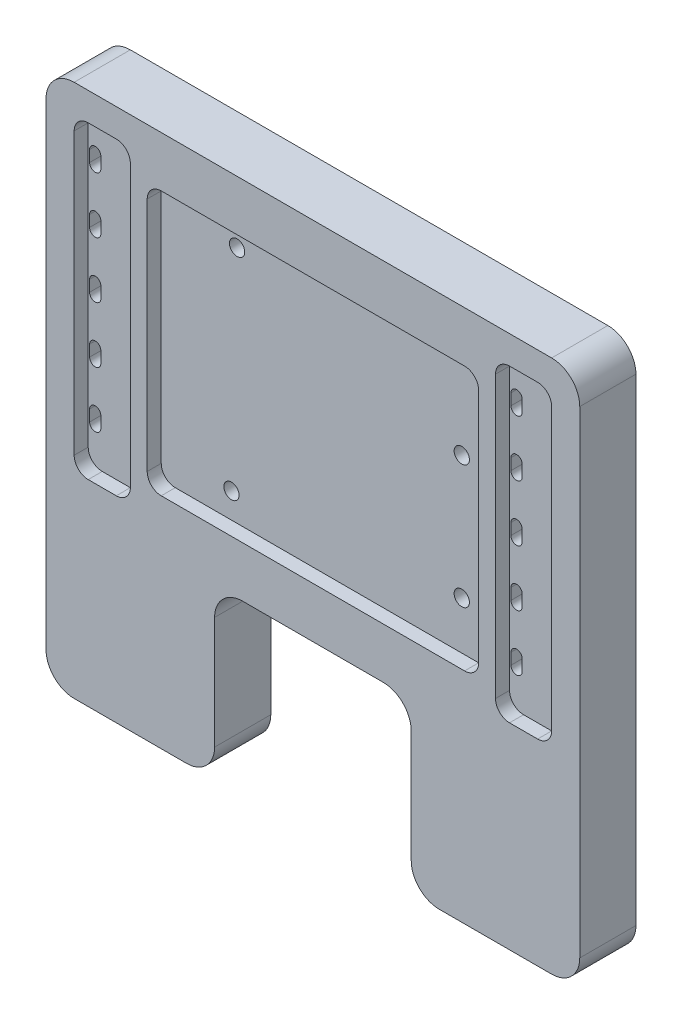
from build123d import *

# Parameters (mm, degrees)
BOSS_EXTRUDE1_DEPTH   = 12.7
SKETCH5_W             = 12.7
SKETCH5_H             = 69.85
SKETCH5_W_2           = 74.93
SKETCH5_H_2           = 59.69
CUT_EXTRUDE1_DEPTH    = 3.175
F_4_CLEARANCE_HOLE1_D = 3.4544
CUT_EXTRUDE2_DEPTH    = 2.38125
CUT_EXTRUDE3_DEPTH    = 136.226675438
FILLET1_R             = 6.35
FILLET2_R             = 3.175


with BuildPart() as part:
    # Sketch1 → Boss-Extrude1 (new body)
    with BuildSketch(Plane.XY):
        Polygon((-60.325, 0), (60.325, 0), (60.325, -120.65), (22.225, -120.65), (22.225, -82.55), (-22.225, -82.55), (-22.225, -120.65), (-60.325, -120.65), align=None)
    extrude(amount=BOSS_EXTRUDE1_DEPTH)

    # Sketch5 → Cut-Extrude1 (cut)
    with BuildSketch(Plane.XY.offset(12.7)):
        with Locations((47.625, -41.275)):
            Rectangle(SKETCH5_W, SKETCH5_H)
        with Locations((0, -41.275)):
            Rectangle(SKETCH5_W_2, SKETCH5_H_2)
        with Locations((-47.625, -41.275)):
            Rectangle(SKETCH5_W, SKETCH5_H)
    extrude(amount=-CUT_EXTRUDE1_DEPTH, mode=Mode.SUBTRACT)

    # #4 Clearance Hole1 (through all)
    with Locations(Plane.XY.offset(12.7)):
        with Locations((-20.32, -17.145), (-21.59, -65.405), (30.48, -60.325), (30.48, -32.385)):
            Hole(F_4_CLEARANCE_HOLE1_D / 2)

    # Sketch6 → Cut-Extrude2 (cut)
    with BuildSketch(Plane(origin=(0, 0, 0), x_dir=(-1, 0, 0), z_dir=(0, 0, -1))):
        Polygon((22.382222993, -20.716875), (24.444445986, -17.145), (22.382222993, -13.573125), (18.257777007, -13.573125), (16.195554014, -17.145), (18.257777007, -20.716875), align=None)
        Polygon((23.652222993, -68.976875), (25.714445986, -65.405), (23.652222993, -61.833125), (19.527777007, -61.833125), (17.465554014, -65.405), (19.527777007, -68.976875), align=None)
        Polygon((-28.417777007, -63.896875), (-26.355554014, -60.325), (-28.417777007, -56.753125), (-32.542222993, -56.753125), (-34.604445986, -60.325), (-32.542222993, -63.896875), align=None)
        Polygon((-28.417777007, -35.956875), (-26.355554014, -32.385), (-28.417777007, -28.813125), (-32.542222993, -28.813125), (-34.604445986, -32.385), (-32.542222993, -35.956875), align=None)
    extrude(amount=-CUT_EXTRUDE2_DEPTH, mode=Mode.SUBTRACT)

    # Sketch7 → Cut-Extrude3 (cut, through all)
    with BuildSketch(Plane.XY.offset(9.525)):
        with BuildLine():
            Line((53.6575, -14.605), (53.6575, -17.145))
            ThreePointArc((53.6575, -17.145), (52.3875, -18.415), (51.1175, -17.145))
            Line((51.1175, -17.145), (51.1175, -14.605))
            ThreePointArc((51.1175, -14.605), (52.3875, -13.335), (53.6575, -14.605))
        make_face()
        with BuildLine():
            Line((53.6575, -27.305), (53.6575, -29.845))
            ThreePointArc((53.6575, -29.845), (52.3875, -31.115), (51.1175, -29.845))
            Line((51.1175, -29.845), (51.1175, -27.305))
            ThreePointArc((51.1175, -27.305), (52.3875, -26.035), (53.6575, -27.305))
        make_face()
        with BuildLine():
            Line((53.6575, -40.005), (53.6575, -42.545))
            ThreePointArc((53.6575, -42.545), (52.3875, -43.815), (51.1175, -42.545))
            Line((51.1175, -42.545), (51.1175, -40.005))
            ThreePointArc((51.1175, -40.005), (52.3875, -38.735), (53.6575, -40.005))
        make_face()
        with BuildLine():
            Line((53.6575, -52.705), (53.6575, -55.245))
            ThreePointArc((53.6575, -55.245), (52.3875, -56.515), (51.1175, -55.245))
            Line((51.1175, -55.245), (51.1175, -52.705))
            ThreePointArc((51.1175, -52.705), (52.3875, -51.435), (53.6575, -52.705))
        make_face()
        with BuildLine():
            Line((53.6575, -65.405), (53.6575, -67.945))
            ThreePointArc((53.6575, -67.945), (52.3875, -69.215), (51.1175, -67.945))
            Line((51.1175, -67.945), (51.1175, -65.405))
            ThreePointArc((51.1175, -65.405), (52.3875, -64.135), (53.6575, -65.405))
        make_face()
        with BuildLine():
            Line((41.5925, -65.405), (41.5925, -67.945))
            ThreePointArc((41.5925, -67.945), (42.8625, -69.215), (44.1325, -67.945))
            Line((44.1325, -67.945), (44.1325, -65.405))
            ThreePointArc((44.1325, -65.405), (42.8625, -64.135), (41.5925, -65.405))
        make_face()
        with BuildLine():
            Line((41.5925, -52.705), (41.5925, -55.245))
            ThreePointArc((41.5925, -55.245), (42.8625, -56.515), (44.1325, -55.245))
            Line((44.1325, -55.245), (44.1325, -52.705))
            ThreePointArc((44.1325, -52.705), (42.8625, -51.435), (41.5925, -52.705))
        make_face()
        with BuildLine():
            Line((41.5925, -40.005), (41.5925, -42.545))
            ThreePointArc((41.5925, -42.545), (42.8625, -43.815), (44.1325, -42.545))
            Line((44.1325, -42.545), (44.1325, -40.005))
            ThreePointArc((44.1325, -40.005), (42.8625, -38.735), (41.5925, -40.005))
        make_face()
        with BuildLine():
            Line((41.5925, -27.305), (41.5925, -29.845))
            ThreePointArc((41.5925, -29.845), (42.8625, -31.115), (44.1325, -29.845))
            Line((44.1325, -29.845), (44.1325, -27.305))
            ThreePointArc((44.1325, -27.305), (42.8625, -26.035), (41.5925, -27.305))
        make_face()
        with BuildLine():
            Line((41.5925, -14.605), (41.5925, -17.145))
            ThreePointArc((41.5925, -17.145), (42.8625, -18.415), (44.1325, -17.145))
            Line((44.1325, -17.145), (44.1325, -14.605))
            ThreePointArc((44.1325, -14.605), (42.8625, -13.335), (41.5925, -14.605))
        make_face()
        with BuildLine():
            Line((-53.6575, -14.605), (-53.6575, -17.145))
            ThreePointArc((-53.6575, -17.145), (-52.3875, -18.415), (-51.1175, -17.145))
            Line((-51.1175, -17.145), (-51.1175, -14.605))
            ThreePointArc((-51.1175, -14.605), (-52.3875, -13.335), (-53.6575, -14.605))
        make_face()
        with BuildLine():
            Line((-53.6575, -27.305), (-53.6575, -29.845))
            ThreePointArc((-53.6575, -29.845), (-52.3875, -31.115), (-51.1175, -29.845))
            Line((-51.1175, -29.845), (-51.1175, -27.305))
            ThreePointArc((-51.1175, -27.305), (-52.3875, -26.035), (-53.6575, -27.305))
        make_face()
        with BuildLine():
            Line((-53.6575, -40.005), (-53.6575, -42.545))
            ThreePointArc((-53.6575, -42.545), (-52.3875, -43.815), (-51.1175, -42.545))
            Line((-51.1175, -42.545), (-51.1175, -40.005))
            ThreePointArc((-51.1175, -40.005), (-52.3875, -38.735), (-53.6575, -40.005))
        make_face()
        with BuildLine():
            Line((-53.6575, -52.705), (-53.6575, -55.245))
            ThreePointArc((-53.6575, -55.245), (-52.3875, -56.515), (-51.1175, -55.245))
            Line((-51.1175, -55.245), (-51.1175, -52.705))
            ThreePointArc((-51.1175, -52.705), (-52.3875, -51.435), (-53.6575, -52.705))
        make_face()
        with BuildLine():
            Line((-53.6575, -65.405), (-53.6575, -67.945))
            ThreePointArc((-53.6575, -67.945), (-52.3875, -69.215), (-51.1175, -67.945))
            Line((-51.1175, -67.945), (-51.1175, -65.405))
            ThreePointArc((-51.1175, -65.405), (-52.3875, -64.135), (-53.6575, -65.405))
        make_face()
        with BuildLine():
            Line((-41.5925, -65.405), (-41.5925, -67.945))
            ThreePointArc((-41.5925, -67.945), (-42.8625, -69.215), (-44.1325, -67.945))
            Line((-44.1325, -67.945), (-44.1325, -65.405))
            ThreePointArc((-44.1325, -65.405), (-42.8625, -64.135), (-41.5925, -65.405))
        make_face()
        with BuildLine():
            Line((-41.5925, -52.705), (-41.5925, -55.245))
            ThreePointArc((-41.5925, -55.245), (-42.8625, -56.515), (-44.1325, -55.245))
            Line((-44.1325, -55.245), (-44.1325, -52.705))
            ThreePointArc((-44.1325, -52.705), (-42.8625, -51.435), (-41.5925, -52.705))
        make_face()
        with BuildLine():
            Line((-41.5925, -40.005), (-41.5925, -42.545))
            ThreePointArc((-41.5925, -42.545), (-42.8625, -43.815), (-44.1325, -42.545))
            Line((-44.1325, -42.545), (-44.1325, -40.005))
            ThreePointArc((-44.1325, -40.005), (-42.8625, -38.735), (-41.5925, -40.005))
        make_face()
        with BuildLine():
            Line((-41.5925, -27.305), (-41.5925, -29.845))
            ThreePointArc((-41.5925, -29.845), (-42.8625, -31.115), (-44.1325, -29.845))
            Line((-44.1325, -29.845), (-44.1325, -27.305))
            ThreePointArc((-44.1325, -27.305), (-42.8625, -26.035), (-41.5925, -27.305))
        make_face()
        with BuildLine():
            Line((-41.5925, -14.605), (-41.5925, -17.145))
            ThreePointArc((-41.5925, -17.145), (-42.8625, -18.415), (-44.1325, -17.145))
            Line((-44.1325, -17.145), (-44.1325, -14.605))
            ThreePointArc((-44.1325, -14.605), (-42.8625, -13.335), (-41.5925, -14.605))
        make_face()
    extrude(amount=-CUT_EXTRUDE3_DEPTH, mode=Mode.SUBTRACT)

    # Fillet1
    fillet1_edges = [part.edges().sort_by_distance(p)[0] for p in [
        (-60.325, 0, 6.35),
        (60.325, 0, 6.35),
        (60.325, -120.65, 6.35),
        (22.225, -120.65, 6.35),
        (22.225, -82.55, 6.35),
        (-22.225, -82.55, 6.35),
        (-22.225, -120.65, 6.35),
        (-60.325, -120.65, 6.35),
    ]]
    fillet(fillet1_edges, radius=FILLET1_R)

    # Fillet2
    fillet2_edges = [part.edges().sort_by_distance(p)[0] for p in [
        (41.275, -6.35, 11.1125),
        (53.975, -6.35, 11.1125),
        (53.975, -76.2, 11.1125),
        (41.275, -76.2, 11.1125),
        (-53.975, -76.2, 11.1125),
        (-53.975, -6.35, 11.1125),
        (-41.275, -6.35, 11.1125),
        (-41.275, -76.2, 11.1125),
        (-37.465, -71.12, 11.1125),
        (-37.465, -11.43, 11.1125),
        (37.465, -11.43, 11.1125),
        (37.465, -71.12, 11.1125),
    ]]
    fillet(fillet2_edges, radius=FILLET2_R)


solid = part.part
